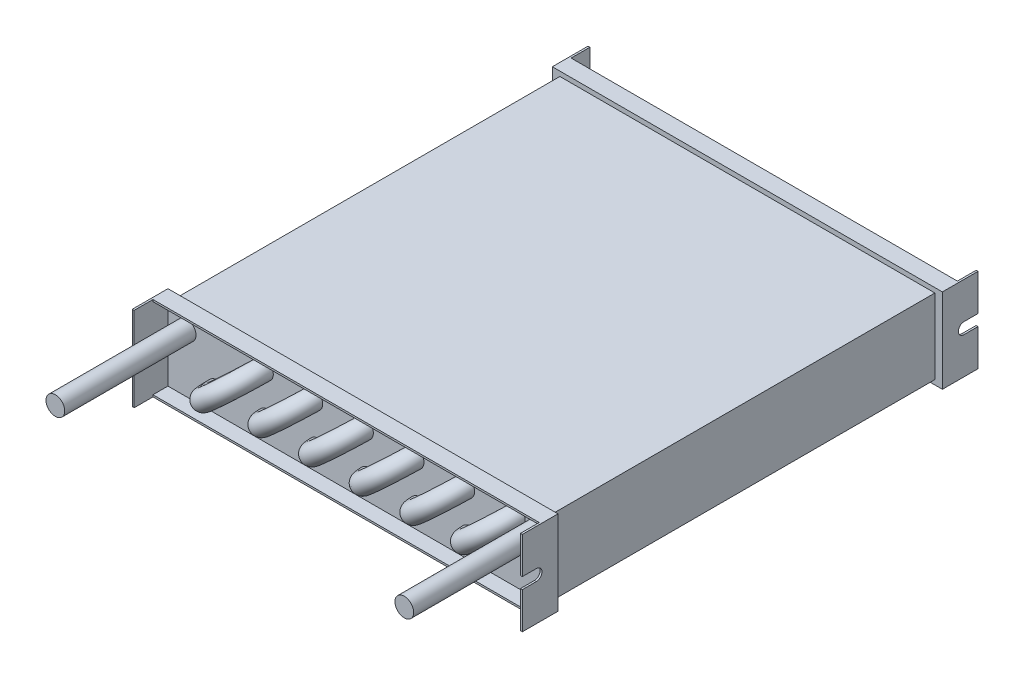
from build123d import *

# Parameters (mm, degrees)
SKETCH1_W             = 208
SKETCH1_H             = 45
BOSS_EXTRUDE1_DEPTH   = 9
SHELL1_T              = -1
SKETCH2_W             = 200
SKETCH2_H             = 40
BOSS_EXTRUDE2_DEPTH   = 205
SKETCH4_R             = 5
BOSS_EXTRUDE3_DEPTH   = 70
SKETCH9_W             = 10
SKETCH9_H             = 45
BOSS_EXTRUDE7_DEPTH   = 1
CUT_EXTRUDE2_DEPTH    = 4
BOSS_EXTRUDE8_DEPTH   = 1
SKETCH20_W            = 206
SKETCH20_H            = 43
CUT_EXTRUDE4_DEPTH    = 8
MIRROR17_COPY_1_DEPTH = 4
MIRROR17_COPY_2_DEPTH = 4
MIRROR20_COPY_1_DEPTH = 4
MIRROR20_COPY_2_DEPTH = 4
SKETCH32_R            = 5
LPATTERN1_COUNT       = 6
LPATTERN1_PITCH       = 27


with BuildPart() as part:
    # Sketch1 → Boss-Extrude1 (new body)
    with BuildSketch(Plane.XY):
        Rectangle(SKETCH1_W, SKETCH1_H)
    boss_extrude1 = extrude(amount=BOSS_EXTRUDE1_DEPTH)

    # Shell1
    shell1_openings = [part.faces().sort_by_distance(p)[0] for p in [
        (0, 0, 9),
    ]]
    offset(amount=SHELL1_T, openings=shell1_openings, kind=Kind.INTERSECTION)

    # Sketch2 → Boss-Extrude2 (add)
    with BuildSketch(Plane(origin=(0, 0, 0), x_dir=(-1, 0, 0), z_dir=(0, 0, -1))):
        Rectangle(SKETCH2_W, SKETCH2_H)
    extrude(amount=BOSS_EXTRUDE2_DEPTH)

    # Mirror4: Boss-Extrude1 across plane
    add(boss_extrude1.mirror(Plane.XY.offset(-102.5)))

    # Sketch4 → Boss-Extrude3 (add)
    with BuildSketch(Plane.XY.offset(1)):
        with Locations(Location((-93.03510696, 9.465396689, 0), (0, 0, 180))):
            Circle(SKETCH4_R)
    boss_extrude3 = extrude(amount=BOSS_EXTRUDE3_DEPTH)

    # Sketch9 → Boss-Extrude7 (add)
    with BuildSketch(Plane(origin=(104, 0, 0), x_dir=(0, 0, -1), z_dir=(1, 0, 0))):
        with Locations((-14, 0)):
            Rectangle(SKETCH9_W, SKETCH9_H)
    boss_extrude7 = extrude(amount=-BOSS_EXTRUDE7_DEPTH)

    # Sketch11 → Cut-Extrude2 (cut)
    with BuildSketch(Plane(origin=(104, 0, 0), x_dir=(0, 0, -1), z_dir=(1, 0, 0))):
        with BuildLine():
            ThreePointArc((-11.52895443, -3), (-8.52895443, 0), (-11.52895443, 3))
            Line((-11.52895443, 3), (-19, 3))
            Line((-19, 3), (-19, -3))
            Line((-19, -3), (-11.52895443, -3))
        make_face()
    cut_extrude2 = extrude(amount=-CUT_EXTRUDE2_DEPTH, mode=Mode.SUBTRACT)

    # Sketch15 → Boss-Extrude8 (add)
    with BuildSketch(Plane.ZY.offset(104)):
        Polygon((9, 22.5), (19, 22.5), (19, 3), (19, -22.5), (9, -22.5), align=None)
    boss_extrude8 = extrude(amount=-BOSS_EXTRUDE8_DEPTH)


with BuildPart() as mirror8_1:
    # Mirror8: Boss-Extrude1 across plane
    add(boss_extrude1.mirror(Plane.XY.offset(-102.5)))


with BuildPart() as part_1:
    add(part.part)

    # Mirror8 united with what the copies touc: union Mirror8_1
    add(mirror8_1.part)


with BuildPart() as mirror9_1:
    # Mirror9: Boss-Extrude1 across plane
    add(boss_extrude1.mirror(Plane.XY.offset(-102.5)))


with BuildPart() as part_2:
    add(part_1.part)

    # Mirror9 united with what the copies touc: union Mirror9_1
    add(mirror9_1.part)

    # Sketch20 → Cut-Extrude4 (cut)
    with BuildSketch(Plane(origin=(0, 0, -214), x_dir=(-1, 0, 0), z_dir=(0, 0, -1))):
        Rectangle(SKETCH20_W, SKETCH20_H)
    extrude(amount=-CUT_EXTRUDE4_DEPTH, mode=Mode.SUBTRACT)

    # Mirror12: Boss-Extrude7, Cut-Extrude2 across plane
    add(boss_extrude7.mirror(Plane.XY.offset(-102.5)))
    add(cut_extrude2.mirror(Plane.XY.offset(-102.5)), mode=Mode.SUBTRACT)

    # Mirror13: Boss-Extrude3 across plane
    add(boss_extrude3.mirror(Plane(origin=(0, 0, 0), x_dir=(0, 0, 1), z_dir=(1, 0, 0))))

    # Mirror14: Cut-Extrude2 across plane
    add(cut_extrude2.mirror(Plane(origin=(0, 0, 0), x_dir=(0, 0, 1), z_dir=(1, 0, 0))), mode=Mode.SUBTRACT)

    # Mirror17 copy 1 sketch → Mirror17 copy 1 (cut)
    with BuildSketch(Plane(origin=(-104, 0, -205), x_dir=(0, 0, 1), z_dir=(-1, 0, 0))):
        with BuildLine():
            ThreePointArc((-11.52895443, -3), (-8.52895443, 0), (-11.52895443, 3))
            Line((-11.52895443, 3), (-19, 3))
            Line((-19, 3), (-19, -3))
            Line((-19, -3), (-11.52895443, -3))
        make_face()
    extrude(amount=-MIRROR17_COPY_1_DEPTH, mode=Mode.SUBTRACT)

    # Mirror17 copy 2 sketch → Mirror17 copy 2 (cut)
    with BuildSketch(Plane(origin=(104, 0, -205), x_dir=(0, 0, 1), z_dir=(1, 0, 0))):
        with BuildLine():
            ThreePointArc((-11.52895443, 3), (-8.52895443, 0), (-11.52895443, -3))
            Line((-11.52895443, -3), (-19, -3))
            Line((-19, -3), (-19, 3))
            Line((-19, 3), (-11.52895443, 3))
        make_face()
    extrude(amount=-MIRROR17_COPY_2_DEPTH, mode=Mode.SUBTRACT)

    # Mirror19: Boss-Extrude8 across plane
    add(boss_extrude8.mirror(Plane.XY.offset(-102.5)))

    # Mirror20 copy 1 sketch → Mirror20 copy 1 (cut)
    with BuildSketch(Plane(origin=(-104, 0, -205), x_dir=(0, 0, 1), z_dir=(-1, 0, 0))):
        with BuildLine():
            ThreePointArc((-11.52895443, -3), (-8.52895443, 0), (-11.52895443, 3))
            Line((-11.52895443, 3), (-19, 3))
            Line((-19, 3), (-19, -3))
            Line((-19, -3), (-11.52895443, -3))
        make_face()
    extrude(amount=-MIRROR20_COPY_1_DEPTH, mode=Mode.SUBTRACT)

    # Mirror20 copy 2 sketch → Mirror20 copy 2 (cut)
    with BuildSketch(Plane(origin=(104, 0, -205), x_dir=(0, 0, 1), z_dir=(1, 0, 0))):
        with BuildLine():
            ThreePointArc((-11.52895443, 3), (-8.52895443, 0), (-11.52895443, -3))
            Line((-11.52895443, -3), (-19, -3))
            Line((-19, -3), (-19, 3))
            Line((-19, 3), (-11.52895443, 3))
        make_face()
    extrude(amount=-MIRROR20_COPY_2_DEPTH, mode=Mode.SUBTRACT)

    # Sweep1: sweep along a path in Sketch28
    with BuildLine(Plane(origin=(-29.118711525, 32.387523673, 0), x_dir=(0.7436372372514424, 0.6685833226853942, 0), z_dir=(-0.6685833226853942, 0.7436372372514424, 0))) as sweep1_path:
        Line((-65.51595987, 5.535957162), (-65.51595987, 203.445502049))
        ThreePointArc((-65.51595987, 203.445502049), (-48.01595987, 220.945502049), (-30.51595987, 203.445502049))
        Line((-30.51595987, 203.445502049), (-30.51595987, 5.535957162))
        ThreePointArc((-30.51595987, 5.535957162), (-48.01595987, -11.964042838), (-65.51595987, 5.535957162))
    # Sketch32 → Sweep1 (sweep)
    with BuildSketch(Plane(origin=(0, 0, -206), x_dir=(-1, 0, 0), z_dir=(0, 0, -1))):
        with Locations((51.811515615, 11.985061828)):
            Circle(SKETCH32_R)
    sweep1 = sweep(path=sweep1_path.line)

    # Mirror21: Sweep1 across plane
    add(sweep1.mirror(Plane.XY.offset(-102.5)))

    # LPattern1: Sweep1 ×6
    with Locations(*[(i * LPATTERN1_PITCH, 0, 0) for i in range(1, LPATTERN1_COUNT)]):
        add(sweep1)


solid = part_2.part
